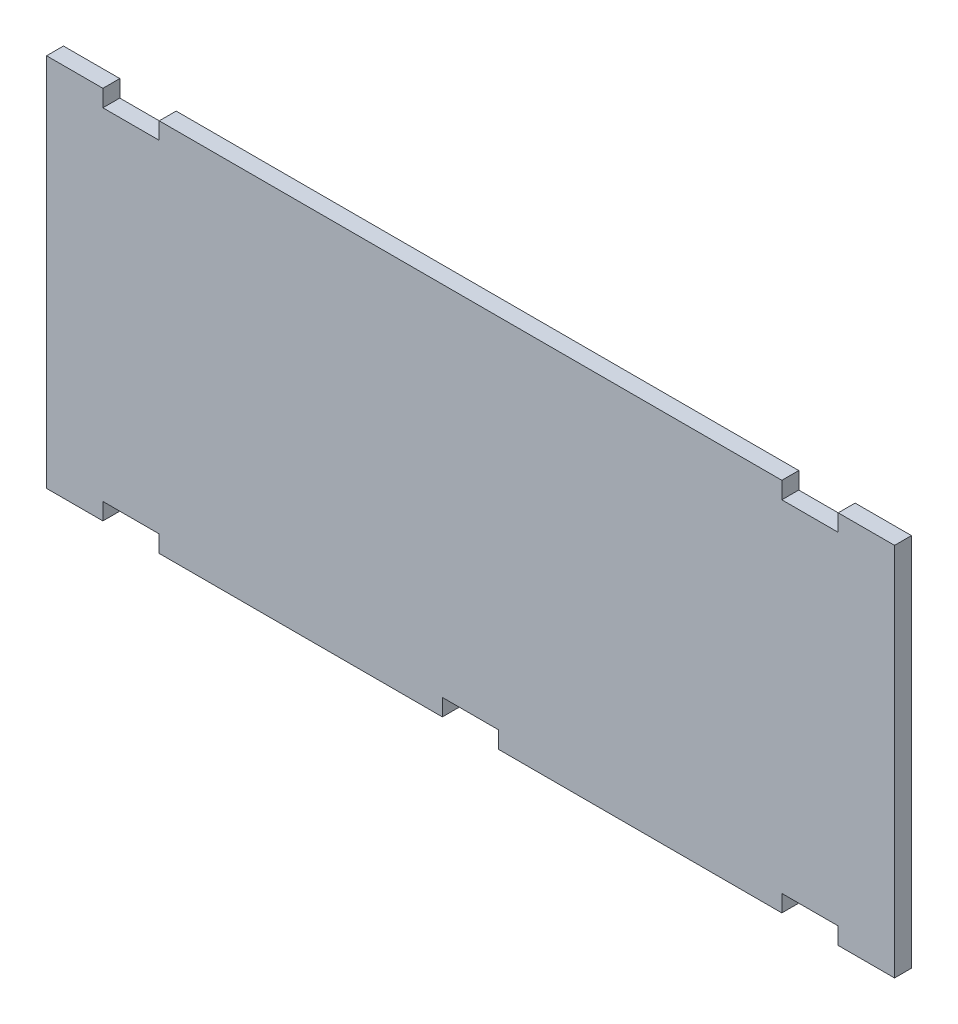
from build123d import *

# Parameters (mm, degrees)
BOSS_EXTRU_1_DEPTH = 6


with BuildPart() as part:
    # Esquisse1 → Boss.-Extru.1 (new body)
    with BuildSketch(Plane.XY):
        Polygon((-20, 0), (-20, 6), (-40, 6), (-40, 0), (-140.5, 0), (-140.5, 6), (-160.5, 6), (-160.5, 0), (-261, 0), (-261, 6), (-281, 6), (-281, 0), (-301, 0), (-301, 133), (-281, 133), (-281, 127), (-261, 127), (-261, 133), (-40, 133), (-40, 127), (-20, 127), (-20, 133), (0, 133), (0, 0), align=None)
    extrude(amount=BOSS_EXTRU_1_DEPTH)


solid = part.part
